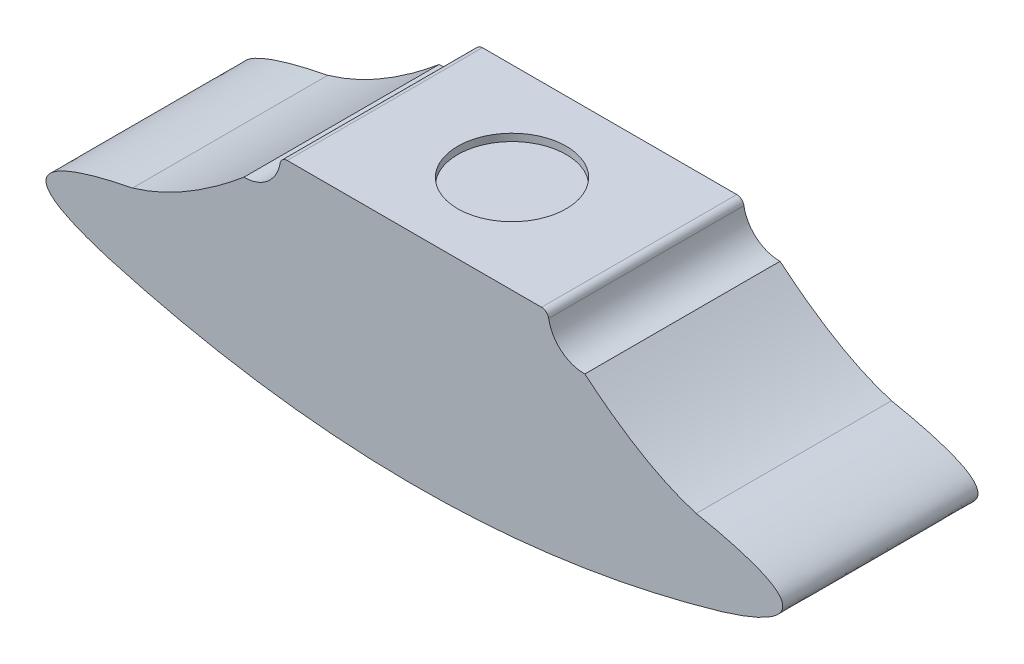
from build123d import *

# Parameters (mm, degrees)
BOSS_EXTRUDE2_DEPTH = 27
BOSS_EXTRUDE3_DEPTH = 27
SKETCH2_W           = 35
SKETCH2_H           = 30
CUT_EXTRUDE1_DEPTH  = 5
FILLET1_R           = 1
SKETCH3_R           = 7.5
CUT_EXTRUDE2_DEPTH  = 1
FILLET2_R           = 1
FILLET3_R           = 1


with BuildPart() as part:
    # Sketch1 → Boss-Extrude2 (new body)
    with BuildSketch(Plane.XY):
        with BuildLine():
            Line((0, -6.138464618), (0, 24))
            Line((0, 24), (-18.5, 24))
            ThreePointArc((-18.5, 24), (-19.98907726, 20.440025069), (-23.569368605, 19.000481223))
            add(Edge.make_bspline(
                [(-38.977266034, 10), (-31.868069792, 12.073515571), (-23.569368605, 19.000481223)],
                knots=[0, 0, 0, 1, 1, 1], degree=2))
            add(Edge.make_bspline(
                [(-42.5, 0), (-60.990919768, 5.63165305), (-38.977266034, 10)],
                knots=[0, 0, 0, 1, 1, 1], degree=2))
            add(Edge.make_bspline(
                [(0, -6.138464618), (-21.18379083, -6.119278693), (-42.5, 0)],
                knots=[0.501567662, 0.501567662, 0.501567662, 1, 1, 1], degree=2))
        make_face()
    extrude(amount=BOSS_EXTRUDE2_DEPTH)

    # Sketch1<4> → Boss-Extrude3 (add)
    with BuildSketch(Plane.XY):
        with BuildLine():
            Line((18.5, 24), (0, 24))
            Line((0, 24), (0, -6.138464618))
            add(Edge.make_bspline(
                [(42.5, 0), (21.317044751, -6.157771231), (0, -6.138464618)],
                knots=[0, 0, 0, 0.501567662, 0.501567662, 0.501567662], degree=2))
            add(Edge.make_bspline(
                [(42.5, 0), (60.990919768, 5.63165305), (38.977266034, 10)],
                knots=[0, 0, 0, 1, 1, 1], degree=2))
            add(Edge.make_bspline(
                [(38.977266034, 10), (31.868069792, 12.073515571), (23.569368605, 19.000481223)],
                knots=[0, 0, 0, 1, 1, 1], degree=2))
            ThreePointArc((23.569368605, 19.000481223), (19.98907726, 20.440025069), (18.5, 24))
        make_face()
    extrude(amount=BOSS_EXTRUDE3_DEPTH)

    # Sketch2 → Cut-Extrude1 (cut)
    with BuildSketch(Plane(origin=(0, 0, 0), x_dir=(-1, 0, 0), z_dir=(0, 0, -1))):
        with Locations((0, 5)):
            Rectangle(SKETCH2_W, SKETCH2_H)
    extrude(amount=-CUT_EXTRUDE1_DEPTH, mode=Mode.SUBTRACT)

    # Fillet1
    fillet1_edges = [part.edges().sort_by_distance(p)[0] for p in [
        (-17.5, 20, 2.5),
        (17.5, 20, 2.5),
    ]]
    fillet(fillet1_edges, radius=FILLET1_R)

    # Sketch3 → Cut-Extrude2 (cut)
    with BuildSketch(Plane(origin=(0, 24, 0), x_dir=(1, 0, 0), z_dir=(0, 1, 0))):
        with Locations((0, -13.5)):
            Circle(SKETCH3_R)
    extrude(amount=-CUT_EXTRUDE2_DEPTH, mode=Mode.SUBTRACT)

    # Fillet2
    fillet2_edges = [part.edges().sort_by_distance(p)[0] for p in [
        (-18.5, 24, 13.5),
    ]]
    fillet(fillet2_edges, radius=FILLET2_R)

    # Fillet3
    fillet3_edges = [part.edges().sort_by_distance(p)[0] for p in [
        (18.5, 24, 13.5),
    ]]
    fillet(fillet3_edges, radius=FILLET3_R)


solid = part.part
